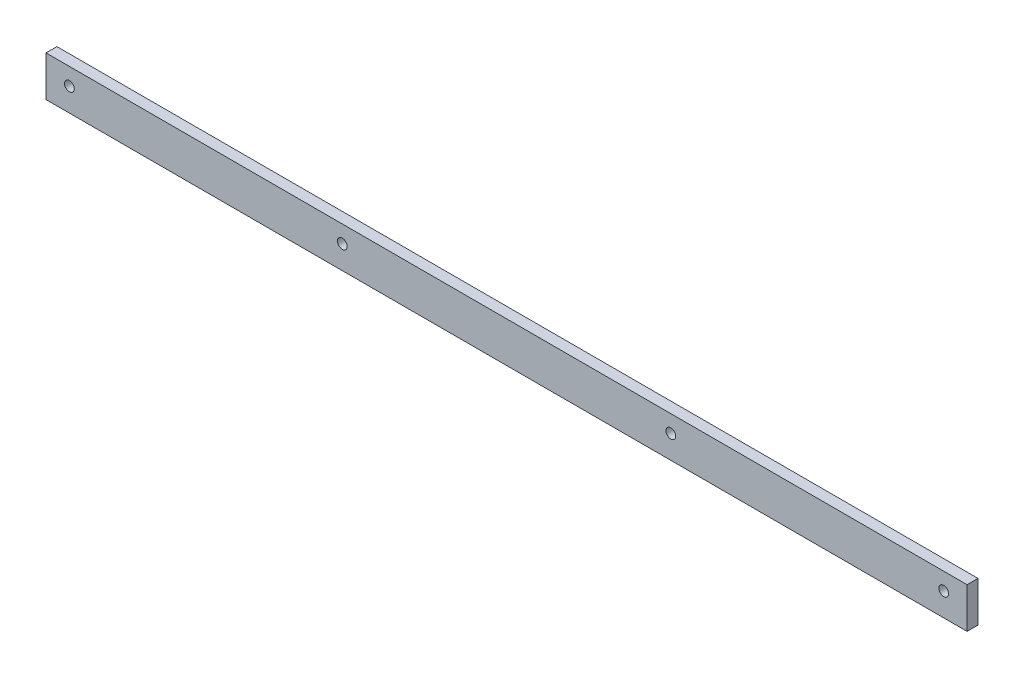
from build123d import *

# Parameters (mm, degrees)
SKETCH1_W           = 268.64
SKETCH1_H           = 11.8
BOSS_EXTRUDE1_DEPTH = 3.18
CUT_EXTRUDE1_REACH  = 136.487
SKETCH3_R           = 1.425


with BuildPart() as part:
    # Sketch1 → Boss-Extrude1 (new body)
    with BuildSketch(Plane.XY):
        Rectangle(SKETCH1_W, SKETCH1_H)
    extrude(amount=BOSS_EXTRUDE1_DEPTH)

    # Sketch3 → Cut-Extrude1 (cut, up to next)
    with BuildSketch(Plane.XY, mode=Mode.PRIVATE) as cut_extrude1_sk1:
        with Locations(Location((127.5, 0.9, 0), (0, 0, 180))):
            Circle(SKETCH3_R)
    cut_extrude1_tool1 = extrude(cut_extrude1_sk1.sketch, amount=CUT_EXTRUDE1_REACH, mode=Mode.PRIVATE) & part.part
    # Sketch3 → Cut-Extrude1 (cut, up to next)
    with BuildSketch(Plane.XY, mode=Mode.PRIVATE) as cut_extrude1_sk2:
        with Locations(Location((47.91, 0.9, 0), (0, 0, 180))):
            Circle(SKETCH3_R)
    cut_extrude1_tool2 = extrude(cut_extrude1_sk2.sketch, amount=CUT_EXTRUDE1_REACH, mode=Mode.PRIVATE) & part.part
    # Sketch3 → Cut-Extrude1 (cut, up to next)
    with BuildSketch(Plane.XY, mode=Mode.PRIVATE) as cut_extrude1_sk3:
        with Locations(Location((-47.91, 0.9, 0), (0, 0, 180))):
            Circle(SKETCH3_R)
    cut_extrude1_tool3 = extrude(cut_extrude1_sk3.sketch, amount=CUT_EXTRUDE1_REACH, mode=Mode.PRIVATE) & part.part
    # Sketch3 → Cut-Extrude1 (cut, up to next)
    with BuildSketch(Plane.XY, mode=Mode.PRIVATE) as cut_extrude1_sk4:
        with Locations(Location((-127.5, 0.9, 0), (0, 0, 180))):
            Circle(SKETCH3_R)
    cut_extrude1_tool4 = extrude(cut_extrude1_sk4.sketch, amount=CUT_EXTRUDE1_REACH, mode=Mode.PRIVATE) & part.part
    add(cut_extrude1_tool1.solids().sort_by_distance((127.5, 0.9, 0))[0], mode=Mode.SUBTRACT)
    add(cut_extrude1_tool2.solids().sort_by_distance((47.91, 0.9, 0))[0], mode=Mode.SUBTRACT)
    add(cut_extrude1_tool3.solids().sort_by_distance((-47.91, 0.9, 0))[0], mode=Mode.SUBTRACT)
    add(cut_extrude1_tool4.solids().sort_by_distance((-127.5, 0.9, 0))[0], mode=Mode.SUBTRACT)


solid = part.part
